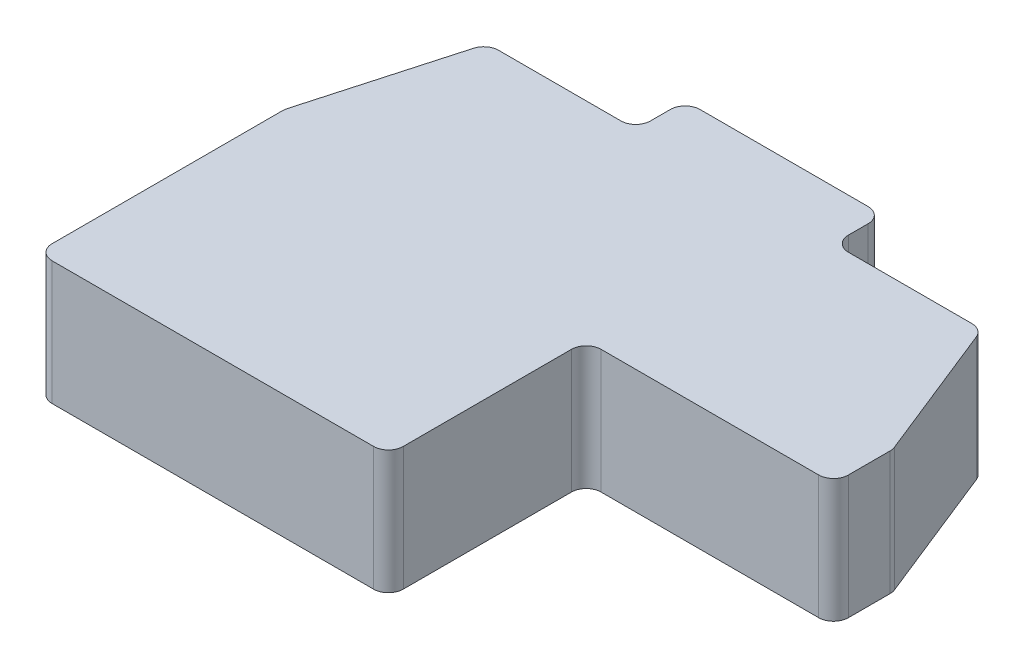
from build123d import *

# Parameters (mm, degrees)
EXTRUDE_1_DEPTH = 25


with BuildPart() as part:
    # 草图1 → 凸台-拉伸1 (new body)
    with BuildSketch(Plane(origin=(0, 0, 0), x_dir=(1, 0, 0), z_dir=(0, 1, 0))):
        with BuildLine():
            Line((0, -3), (0, -37))
            ThreePointArc((0, -37), (-0.878679656, -39.121320344), (-3, -40))
            Line((-3, -40), (-68, -40))
            ThreePointArc((-68, -40), (-70.121320344, -39.121320344), (-71, -37))
            Line((-71, -37), (-71, 9.586153241))
            ThreePointArc((-71, 9.586153241), (-70.971856193, 9.996117592), (-70.88795282, 10.398389972))
            Line((-70.88795282, 10.398389972), (-62.615308419, 39.812236731))
            ThreePointArc((-62.615308419, 39.812236731), (-61.538886693, 41.391308239), (-59.727355599, 42))
            Line((-59.727355599, 42), (-35, 42))
            ThreePointArc((-35, 42), (-32.878679656, 42.878679656), (-32, 45))
            Line((-32, 45), (-32, 49))
            ThreePointArc((-32, 49), (-31.121320344, 51.121320344), (-29, 52))
            Line((-29, 52), (5, 52))
            ThreePointArc((5, 52), (7.121320344, 51.121320344), (8, 49))
            Line((8, 49), (8, 45))
            ThreePointArc((8, 45), (8.878679656, 42.878679656), (11, 42))
            Line((11, 42), (35.968901116, 42))
            ThreePointArc((35.968901116, 42), (37.650787544, 41.484201691), (38.754331188, 40.114172029))
            Line((38.754331188, 40.114172029), (49.785430073, 12.536424818))
            ThreePointArc((49.785430073, 12.536424818), (49.94586916, 11.989575353), (50, 11.422252789))
            Line((50, 11.422252789), (50, 3))
            ThreePointArc((50, 3), (49.121320344, 0.878679656), (47, 0))
            Line((47, 0), (3, 0))
            ThreePointArc((3, 0), (0.878679656, -0.878679656), (0, -3))
        make_face()
    extrude(amount=EXTRUDE_1_DEPTH)


solid = part.part
